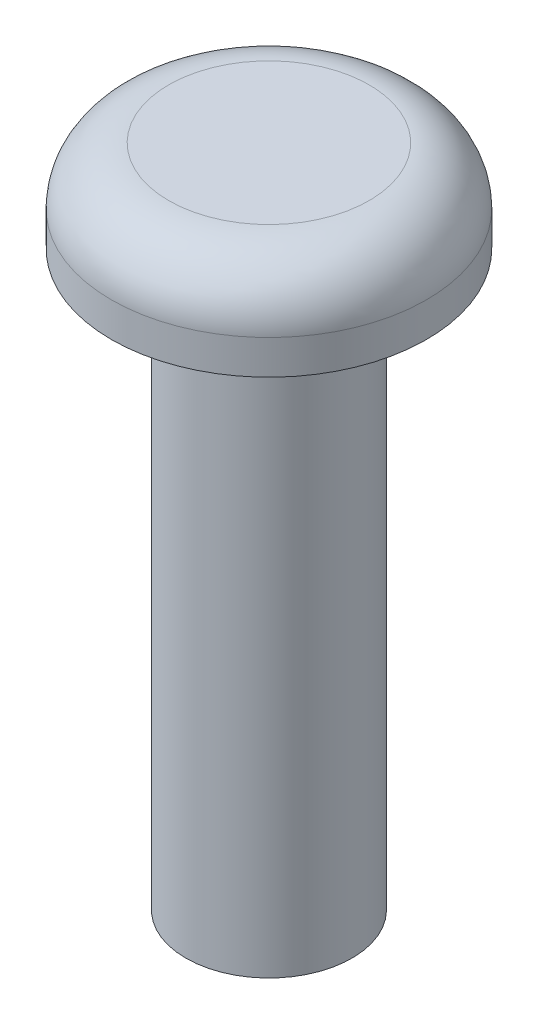
from build123d import *

# Parameters (mm, degrees)
SKETCH1_R           = 1.45
BOSS_EXTRUDE1_DEPTH = 10
SKETCH2_R           = 2.75
BOSS_EXTRUDE2_DEPTH = 1.6
FILLET1_R           = 1


with BuildPart() as part:
    # Sketch1 → Boss-Extrude1 (new body)
    with BuildSketch(Plane(origin=(0, 0, 0), x_dir=(1, 0, 0), z_dir=(0, 1, 0))):
        with Locations(Location((0, 0, 0), (0, 0, 270))):
            Circle(SKETCH1_R)
    extrude(amount=-BOSS_EXTRUDE1_DEPTH)

    # Sketch2 → Boss-Extrude2 (add)
    with BuildSketch(Plane(origin=(0, 0, 0), x_dir=(1, 0, 0), z_dir=(0, 1, 0))):
        with Locations(Location((0, 0, 0), (0, 0, 270))):
            Circle(SKETCH2_R)
    extrude(amount=BOSS_EXTRUDE2_DEPTH)

    # Fillet1
    fillet1_edges = [part.edges().sort_by_distance(p)[0] for p in [
        (0, 1.6, -2.75),
    ]]
    fillet(fillet1_edges, radius=FILLET1_R)


solid = part.part
